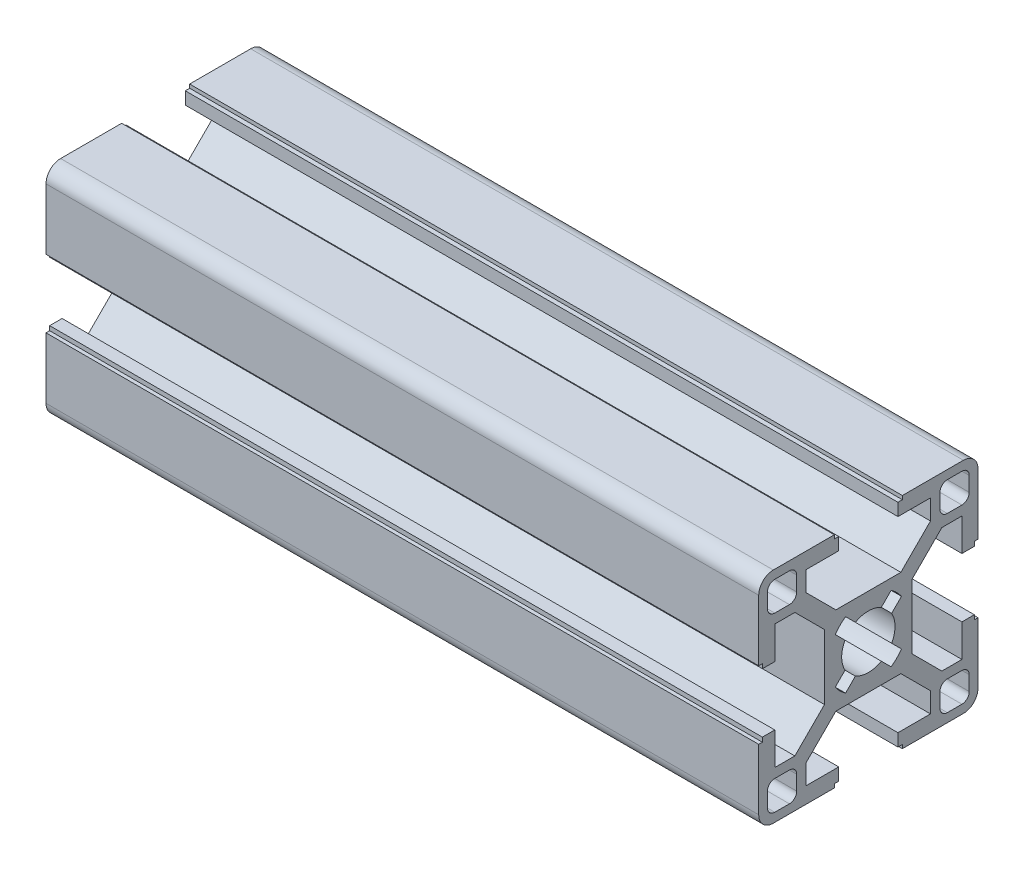
from build123d import *

# Parameters (mm, degrees)
AUFSATZ_LINEAR_AUSTRAGEN1_DEPTH = 130
SCALE1_SCALE_X                  = 1
SCALE1_SCALE_Y                  = 1.333333333
SCALE1_SCALE_Z                  = 1.333333333


with BuildPart() as part:
    # Skizze1 → Aufsatz-Linear austragen1 (new body)
    with BuildSketch(Plane(origin=(0, 0, 0), x_dir=(0, 0, -1), z_dir=(1, 0, 0))):
        with BuildLine():
            Line((10.055634919, 8.5), (12.8, 8.5))
            Line((12.8, 8.5), (12.8, 4.05))
            Line((12.8, 4.05), (14.5, 4.05))
            Line((14.5, 4.05), (14.5, 4.651637069))
            Line((14.5, 4.651637069), (15, 4.651637069))
            Line((15, 4.651637069), (15, 13))
            ThreePointArc((15, 13), (14.414213562, 14.414213562), (13, 15))
            Line((13, 15), (4.651637069, 15))
            Line((4.651637069, 15), (4.651637069, 14.5))
            Line((4.651637069, 14.5), (4.05, 14.5))
            Line((4.05, 14.5), (4.05, 12.8))
            Line((4.05, 12.8), (8.5, 12.8))
            Line((8.5, 12.8), (8.5, 10.055634919))
            Line((8.5, 10.055634919), (4.444365081, 6))
            Line((4.444365081, 6), (-4.444365081, 6))
            Line((-4.444365081, 6), (-8.5, 10.055634919))
            Line((-8.5, 10.055634919), (-8.5, 12.8))
            Line((-8.5, 12.8), (-4.05, 12.8))
            Line((-4.05, 12.8), (-4.05, 14.5))
            Line((-4.05, 14.5), (-4.651637069, 14.5))
            Line((-4.651637069, 14.5), (-4.651637069, 15))
            Line((-4.651637069, 15), (-13, 15))
            ThreePointArc((-13, 15), (-14.414213562, 14.414213562), (-15, 13))
            Line((-15, 13), (-15, 4.651637069))
            Line((-15, 4.651637069), (-14.5, 4.651637069))
            Line((-14.5, 4.651637069), (-14.5, 4.05))
            Line((-14.5, 4.05), (-12.8, 4.05))
            Line((-12.8, 4.05), (-12.8, 8.5))
            Line((-12.8, 8.5), (-10.055634919, 8.5))
            Line((-10.055634919, 8.5), (-6, 4.444365081))
            Line((-6, 4.444365081), (-6, -4.444365081))
            Line((-6, -4.444365081), (-10.055634919, -8.5))
            Line((-10.055634919, -8.5), (-12.8, -8.5))
            Line((-12.8, -8.5), (-12.8, -4.05))
            Line((-12.8, -4.05), (-14.5, -4.05))
            Line((-14.5, -4.05), (-14.5, -4.651637069))
            Line((-14.5, -4.651637069), (-15, -4.651637069))
            Line((-15, -4.651637069), (-15, -13))
            ThreePointArc((-15, -13), (-14.414213562, -14.414213562), (-13, -15))
            Line((-13, -15), (-4.651637069, -15))
            Line((-4.651637069, -15), (-4.651637069, -14.5))
            Line((-4.651637069, -14.5), (-4.05, -14.5))
            Line((-4.05, -14.5), (-4.05, -12.8))
            Line((-4.05, -12.8), (-8.5, -12.8))
            Line((-8.5, -12.8), (-8.5, -10.055634919))
            Line((-8.5, -10.055634919), (-4.444365081, -6))
            Line((-4.444365081, -6), (4.444365081, -6))
            Line((4.444365081, -6), (8.5, -10.055634919))
            Line((8.5, -10.055634919), (8.5, -12.8))
            Line((8.5, -12.8), (4.05, -12.8))
            Line((4.05, -12.8), (4.05, -14.5))
            Line((4.05, -14.5), (4.651637069, -14.5))
            Line((4.651637069, -14.5), (4.651637069, -15))
            Line((4.651637069, -15), (13, -15))
            ThreePointArc((13, -15), (14.414213562, -14.414213562), (15, -13))
            Line((15, -13), (15, -4.651637069))
            Line((15, -4.651637069), (14.5, -4.651637069))
            Line((14.5, -4.651637069), (14.5, -4.05))
            Line((14.5, -4.05), (12.8, -4.05))
            Line((12.8, -4.05), (12.8, -8.5))
            Line((12.8, -8.5), (10.055634919, -8.5))
            Line((10.055634919, -8.5), (6, -4.444365081))
            Line((6, -4.444365081), (6, 4.444365081))
            Line((6, 4.444365081), (10.055634919, 8.5))
        make_face()
        with BuildLine():
            ThreePointArc((12.8, 13.8), (13.507106781, 13.507106781), (13.8, 12.8))
            Line((13.8, 12.8), (13.8, 10.8))
            ThreePointArc((13.8, 10.8), (13.507106781, 10.092893219), (12.8, 9.8))
            Line((12.8, 9.8), (10.8, 9.8))
            ThreePointArc((10.8, 9.8), (10.092893219, 10.092893219), (9.8, 10.8))
            Line((9.8, 10.8), (9.8, 12.8))
            ThreePointArc((9.8, 12.8), (10.092893219, 13.507106781), (10.8, 13.8))
            Line((10.8, 13.8), (12.8, 13.8))
        make_face(mode=Mode.SUBTRACT)
        with BuildLine():
            Line((-3.117157854, 4.531371416), (-1.775079755, 3.189293317))
            ThreePointArc((-1.775079755, 3.189293317), (0, 3.65), (1.775079755, 3.189293317))
            Line((1.775079755, 3.189293317), (3.117157854, 4.531371416))
            ThreePointArc((3.117157854, 4.531371416), (3.889087297, 3.889087297), (4.531371416, 3.117157854))
            Line((4.531371416, 3.117157854), (3.189293317, 1.775079755))
            ThreePointArc((3.189293317, 1.775079755), (3.65, 0), (3.189293317, -1.775079755))
            Line((3.189293317, -1.775079755), (4.531371416, -3.117157854))
            ThreePointArc((4.531371416, -3.117157854), (3.889087297, -3.889087297), (3.117157854, -4.531371416))
            Line((3.117157854, -4.531371416), (1.775079755, -3.189293317))
            ThreePointArc((1.775079755, -3.189293317), (0, -3.65), (-1.775079755, -3.189293317))
            Line((-1.775079755, -3.189293317), (-3.117157854, -4.531371416))
            ThreePointArc((-3.117157854, -4.531371416), (-3.889087297, -3.889087297), (-4.531371416, -3.117157854))
            Line((-4.531371416, -3.117157854), (-3.189293317, -1.775079755))
            ThreePointArc((-3.189293317, -1.775079755), (-3.65, 0), (-3.189293317, 1.775079755))
            Line((-3.189293317, 1.775079755), (-4.531371416, 3.117157854))
            ThreePointArc((-4.531371416, 3.117157854), (-3.889087297, 3.889087297), (-3.117157854, 4.531371416))
        make_face(mode=Mode.SUBTRACT)
        with BuildLine():
            ThreePointArc((-13.8, 12.8), (-13.507106781, 13.507106781), (-12.8, 13.8))
            Line((-12.8, 13.8), (-10.8, 13.8))
            ThreePointArc((-10.8, 13.8), (-10.092893219, 13.507106781), (-9.8, 12.8))
            Line((-9.8, 12.8), (-9.8, 10.8))
            ThreePointArc((-9.8, 10.8), (-10.092893219, 10.092893219), (-10.8, 9.8))
            Line((-10.8, 9.8), (-12.8, 9.8))
            ThreePointArc((-12.8, 9.8), (-13.507106781, 10.092893219), (-13.8, 10.8))
            Line((-13.8, 10.8), (-13.8, 12.8))
        make_face(mode=Mode.SUBTRACT)
        with BuildLine():
            ThreePointArc((9.8, -10.8), (10.092893219, -10.092893219), (10.8, -9.8))
            Line((10.8, -9.8), (12.8, -9.8))
            ThreePointArc((12.8, -9.8), (13.507106781, -10.092893219), (13.8, -10.8))
            Line((13.8, -10.8), (13.8, -12.8))
            ThreePointArc((13.8, -12.8), (13.507106781, -13.507106781), (12.8, -13.8))
            Line((12.8, -13.8), (10.8, -13.8))
            ThreePointArc((10.8, -13.8), (10.092893219, -13.507106781), (9.8, -12.8))
            Line((9.8, -12.8), (9.8, -10.8))
        make_face(mode=Mode.SUBTRACT)
        with BuildLine():
            Line((-9.8, -10.8), (-9.8, -12.8))
            ThreePointArc((-9.8, -12.8), (-10.092893219, -13.507106781), (-10.8, -13.8))
            Line((-10.8, -13.8), (-12.8, -13.8))
            ThreePointArc((-12.8, -13.8), (-13.507106781, -13.507106781), (-13.8, -12.8))
            Line((-13.8, -12.8), (-13.8, -10.8))
            ThreePointArc((-13.8, -10.8), (-13.507106781, -10.092893219), (-12.8, -9.8))
            Line((-12.8, -9.8), (-10.8, -9.8))
            ThreePointArc((-10.8, -9.8), (-10.092893219, -10.092893219), (-9.8, -10.8))
        make_face(mode=Mode.SUBTRACT)
    extrude(amount=AUFSATZ_LINEAR_AUSTRAGEN1_DEPTH)


with BuildPart() as part_1:
    # Scale1: scaled about (65, 0, 0)
    add(part.part.scale((SCALE1_SCALE_X, SCALE1_SCALE_Y, SCALE1_SCALE_Z), about=(65, 0, 0)))


solid = part_1.part
